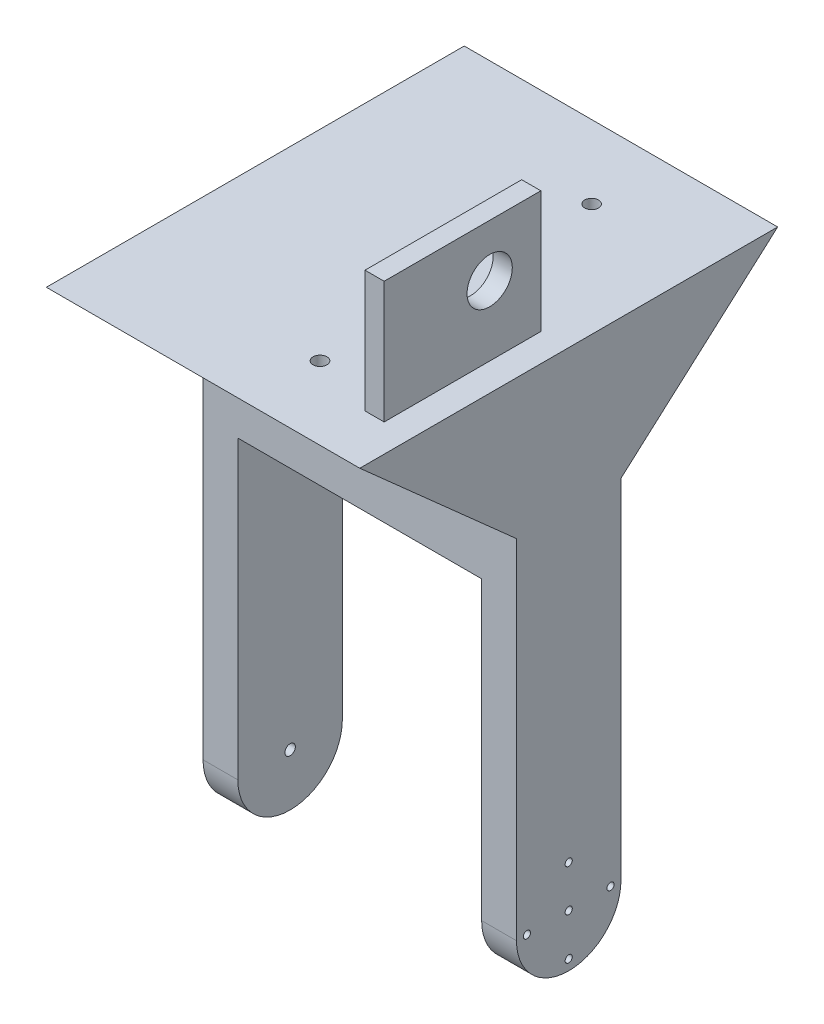
from build123d import *

# Parameters (mm, degrees)
BOSS_EXTRUDE1_DEPTH = 10
SKETCH4_W           = 30
SKETCH4_H           = 15
BOSS_EXTRUDE2_DEPTH = 70
BOSS_EXTRUDE3_DEPTH = 10
SKETCH6_R           = 6.05
CUT_EXTRUDE3_DEPTH  = 3
SKETCH7_R           = 1.025
CUT_EXTRUDE4_DEPTH  = 139.126108227
SKETCH10_R          = 1.5
CUT_EXTRUDE9_DEPTH  = 10
BOSS_EXTRUDE4_DEPTH = 90
SKETCH15_W          = 5.5
SKETCH15_H          = 45
BOSS_EXTRUDE5_DEPTH = 35
SKETCH16_R          = 6.5
CUT_EXTRUDE10_DEPTH = 5.5
SKETCH17_R          = 2
CUT_EXTRUDE11_DEPTH = 34


with BuildPart() as part:
    # Sketch1 → Boss-Extrude1 (new body)
    with BuildSketch(Plane(origin=(0, 0, 0), x_dir=(0, 0, -1), z_dir=(1, 0, 0))):
        with BuildLine():
            Line((15, 11.596692486), (15, 111.596692486))
            Line((15, 111.596692486), (-15, 111.596692486))
            Line((-15, 111.596692486), (-15, 11.596692486))
            ThreePointArc((-15, 11.596692486), (0, -3.403307514), (15, 11.596692486))
        make_face()
    extrude(amount=-BOSS_EXTRUDE1_DEPTH)

    # Sketch4 → Boss-Extrude2 (add)
    with BuildSketch(Plane.ZY.offset(10)):
        with Locations((0, 104.096692486)):
            Rectangle(SKETCH4_W, SKETCH4_H)
    extrude(amount=BOSS_EXTRUDE2_DEPTH)

    # Sketch5 → Boss-Extrude3 (add)
    with BuildSketch(Plane.ZY.offset(80)):
        with BuildLine():
            Line((-15, 111.596692486), (15, 111.596692486))
            Line((15, 111.596692486), (15, 11.596692486))
            ThreePointArc((15, 11.596692486), (0, -3.403307514), (-15, 11.596692486))
            Line((-15, 11.596692486), (-15, 111.596692486))
        make_face()
    extrude(amount=BOSS_EXTRUDE3_DEPTH)

    # Sketch6 → Cut-Extrude3 (cut)
    with BuildSketch(Plane.ZY.offset(10)):
        with Locations((0, 11.596692486)):
            Circle(SKETCH6_R)
    extrude(amount=-CUT_EXTRUDE3_DEPTH, mode=Mode.SUBTRACT)

    # Sketch7 → Cut-Extrude4 (cut, through all)
    with BuildSketch(Plane.ZY.offset(10)):
        with Locations((0, 23.596692486)):
            Circle(SKETCH7_R)
        with Locations((12, 11.596692486)):
            Circle(SKETCH7_R)
        with Locations((0, -0.403307514)):
            Circle(SKETCH7_R)
        with Locations((-12, 11.596692486)):
            Circle(SKETCH7_R)
        with Locations((0, 11.596692486)):
            Circle(SKETCH7_R)
    extrude(amount=-CUT_EXTRUDE4_DEPTH, mode=Mode.SUBTRACT)

    # Sketch10 → Cut-Extrude9 (cut)
    with BuildSketch(Plane.ZY.offset(90)):
        with Locations((0, 11.596692486)):
            Circle(SKETCH10_R)
    extrude(amount=-CUT_EXTRUDE9_DEPTH, mode=Mode.SUBTRACT)

    # Sketch14 → Boss-Extrude4 (add)
    with BuildSketch(Plane.ZY.offset(90)):
        Polygon((-15, 111.596692486), (-60, 151.596692486), (60, 151.596692486), (15, 111.596692486), align=None)
    extrude(amount=-BOSS_EXTRUDE4_DEPTH)

    # Sketch15 → Boss-Extrude5 (add)
    with BuildSketch(Plane(origin=(0, 151.596692486, 0), x_dir=(1, 0, 0), z_dir=(0, 1, 0))):
        with Locations((-10.75, -22.5)):
            Rectangle(SKETCH15_W, SKETCH15_H)
    extrude(amount=BOSS_EXTRUDE5_DEPTH)

    # Sketch16 → Cut-Extrude10 (cut)
    with BuildSketch(Plane(origin=(-8, 0, 0), x_dir=(0, 0, -1), z_dir=(1, 0, 0))):
        with Locations((-14.7, 171.596692486)):
            Circle(SKETCH16_R)
    extrude(amount=-CUT_EXTRUDE10_DEPTH, mode=Mode.SUBTRACT)

    # Sketch17 → Cut-Extrude11 (cut)
    with BuildSketch(Plane(origin=(0, 151.596692486, 0), x_dir=(1, 0, 0), z_dir=(0, 1, 0))):
        with Locations(Location((-32.421605661, 39, 0), (0, 0, 270))):
            Circle(SKETCH17_R)
        with Locations(Location((-32.421605661, -39, 0), (0, 0, 270))):
            Circle(SKETCH17_R)
    extrude(amount=-CUT_EXTRUDE11_DEPTH, mode=Mode.SUBTRACT)


solid = part.part
